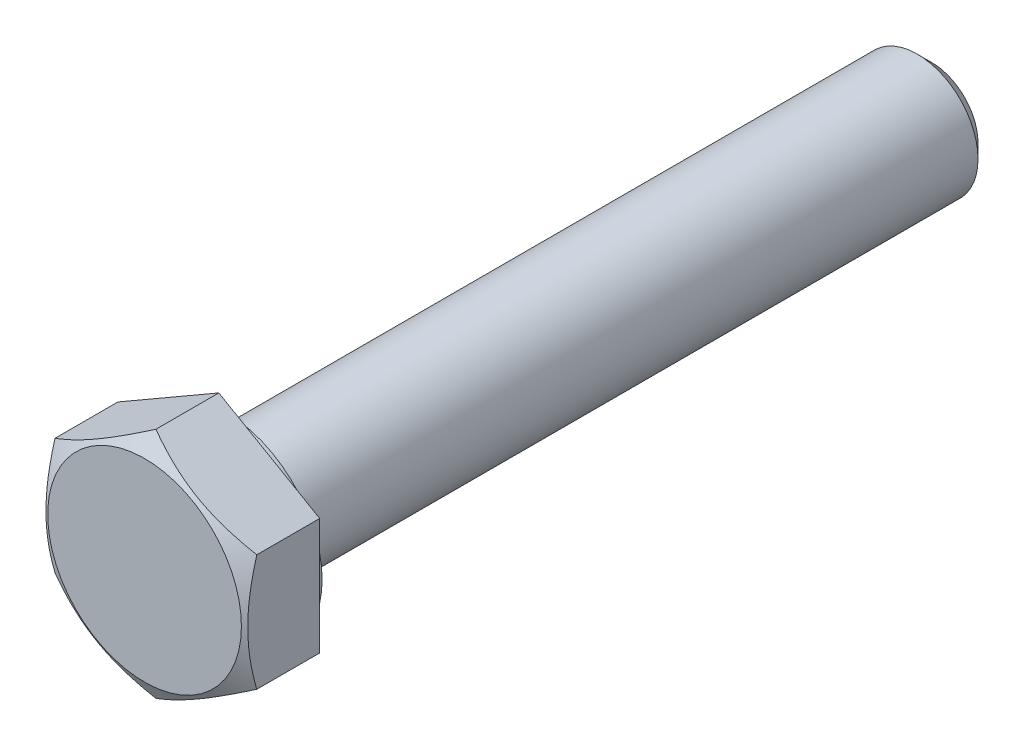
from build123d import *

# Parameters (mm, degrees)
SKETCH4_OUTSIDE_W  = 22.004
SKETCH4_OUTSIDE_H  = 22.004
CUT_EXTRUDE1_DEPTH = 40.845535091


with BuildPart() as part:
    # Sketch3 → Revolve1 (revolve)
    with BuildSketch(Plane(origin=(0, 0, 0), x_dir=(0, 0, -1), z_dir=(1, 0, 0))):
        Polygon((-19.5, 0), (-19.5, 4.8), (-18.937947959, 5.773502692), (-15.82, 5.773502692), (-15.82, 4.8), (-15.5, 4.8), (-15.5, 3), (18.8, 3), (19.5, 2.3), (19.5, 0), align=None)
    revolve(axis=Axis((0, 0, 19.5), (0, 0, -1)))

    # Sketch4 outside → Cut-Extrude1 (cut, through all)
    with BuildSketch(Plane.XY.offset(19.5)):
        Rectangle(SKETCH4_OUTSIDE_W, SKETCH4_OUTSIDE_H)
        Polygon((5, 2.886751346), (0, 5.773502692), (-5, 2.886751346), (-5, -2.886751346), (0, -5.773502692), (5, -2.886751346), align=None, mode=Mode.SUBTRACT)
    extrude(amount=-CUT_EXTRUDE1_DEPTH, mode=Mode.SUBTRACT)


solid = part.part
